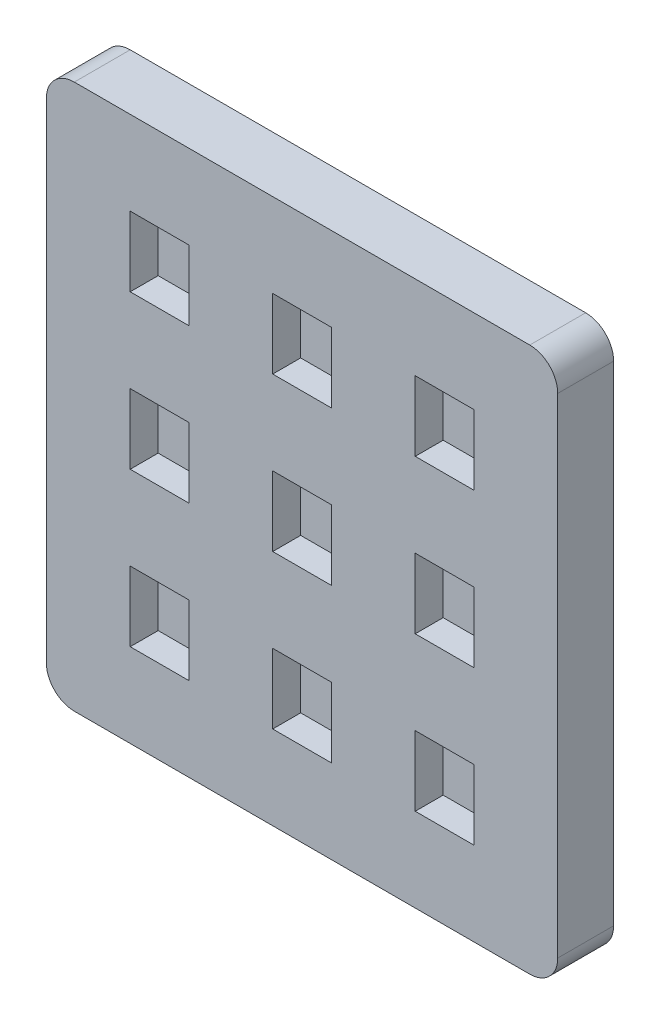
from build123d import *

# Parameters (mm, degrees)
SKETCH1_W           = 183
SKETCH1_H           = 195
BOSS_EXTRUDE2_DEPTH = 20
SKETCH3_W           = 21
SKETCH3_H           = 25
CUT_EXTRUDE1_DEPTH  = 10
CUT_EXTRUDE2_DEPTH  = 135


with BuildPart() as part:
    # Sketch1 → Boss-Extrude2 (new body)
    with BuildSketch(Plane.XY):
        with Locations((91.5, 97.5)):
            Rectangle(SKETCH1_W, SKETCH1_H)
    extrude(amount=BOSS_EXTRUDE2_DEPTH)

    # Sketch3 → Cut-Extrude1 (cut)
    with BuildSketch(Plane.XY.offset(20)):
        with Locations((40.5, 97.5)):
            Rectangle(SKETCH3_W, SKETCH3_H)
        with Locations((40.5, 152.5)):
            Rectangle(SKETCH3_W, SKETCH3_H)
        with Locations((91.5, 152.5)):
            Rectangle(SKETCH3_W, SKETCH3_H)
        with Locations((40.5, 42.5)):
            Rectangle(SKETCH3_W, SKETCH3_H)
        with Locations((91.5, 97.5)):
            Rectangle(SKETCH3_W, SKETCH3_H)
        with Locations((91.5, 42.5)):
            Rectangle(SKETCH3_W, SKETCH3_H)
        with Locations((142.5, 97.5)):
            Rectangle(SKETCH3_W, SKETCH3_H)
        with Locations((142.5, 42.5)):
            Rectangle(SKETCH3_W, SKETCH3_H)
        with Locations((142.5, 152.5)):
            Rectangle(SKETCH3_W, SKETCH3_H)
    extrude(amount=-CUT_EXTRUDE1_DEPTH, mode=Mode.SUBTRACT)

    # Sketch4 → Cut-Extrude2 (cut)
    with BuildSketch(Plane.XY.offset(20)):
        with BuildLine():
            Line((0, 185), (0, 195))
            Line((0, 195), (10, 195))
            ThreePointArc((10, 195), (2.928932188, 192.071067812), (0, 185))
        make_face()
        with BuildLine():
            Line((173, 195), (183, 195))
            Line((183, 195), (183, 185))
            ThreePointArc((183, 185), (180.071067812, 192.071067812), (173, 195))
        make_face()
        with BuildLine():
            Line((183, 10), (183, 0))
            Line((183, 0), (173, 0))
            ThreePointArc((173, 0), (180.071067812, 2.928932188), (183, 10))
        make_face()
        with BuildLine():
            Line((10, 0), (0, 0))
            Line((0, 0), (0, 10))
            ThreePointArc((0, 10), (2.928932188, 2.928932188), (10, 0))
        make_face()
    extrude(amount=-CUT_EXTRUDE2_DEPTH, mode=Mode.SUBTRACT)


solid = part.part
